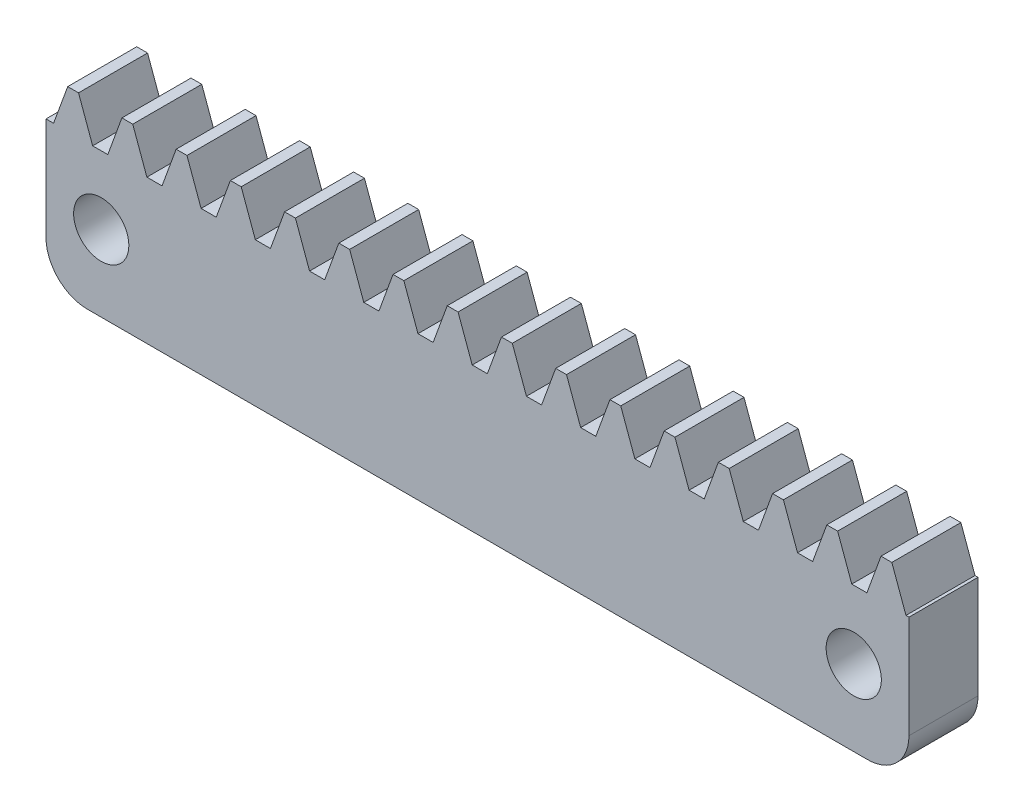
from build123d import *

# Parameters (mm, degrees)
BLANKSKE_W        = 62.5
BLANKSKE_H        = 13.25
BLANKSKE_R        = 2
BLANK_DEPTH       = 5
TOOTHCUTSIM_DEPTH = 65.084416983
TEETHCUTS_COUNT   = 17
TEETHCUTS_PITCH   = 3.926990813
FILLET1_R         = 3


with BuildPart() as part:
    # BlankSke → Blank (new body)
    with BuildSketch(Plane.XY):
        with Locations((31.25, 6.625)):
            Rectangle(BLANKSKE_W, BLANKSKE_H)
        with Locations((4, 5.5)):
            Circle(BLANKSKE_R, mode=Mode.SUBTRACT)
        with Locations(Location((58.5, 5.5, 0), (0, 0, 180))):
            Circle(BLANKSKE_R, mode=Mode.SUBTRACT)
    extrude(amount=-BLANK_DEPTH)

    # TooCutSkeSim → ToothCutSim (cut, through all)
    with BuildSketch(Plane.XY):
        Polygon((0.548044212, 10.4375), (-0.548044212, 10.4375), (-1.58095534, 13.2754), (1.58095534, 13.2754), align=None)
    toothcutsim = extrude(amount=-TOOTHCUTSIM_DEPTH, mode=Mode.SUBTRACT)

    # TeethCuts: ToothCutSim ×17
    with Locations(*[(i * TEETHCUTS_PITCH, 0, 0) for i in range(1, TEETHCUTS_COUNT)]):
        add(toothcutsim, mode=Mode.SUBTRACT)

    # Fillet1
    fillet1_edges = [part.edges().sort_by_distance(p)[0] for p in [
        (62.5, 0, -2.5),
        (0, 0, -2.5),
    ]]
    fillet(fillet1_edges, radius=FILLET1_R)


solid = part.part
